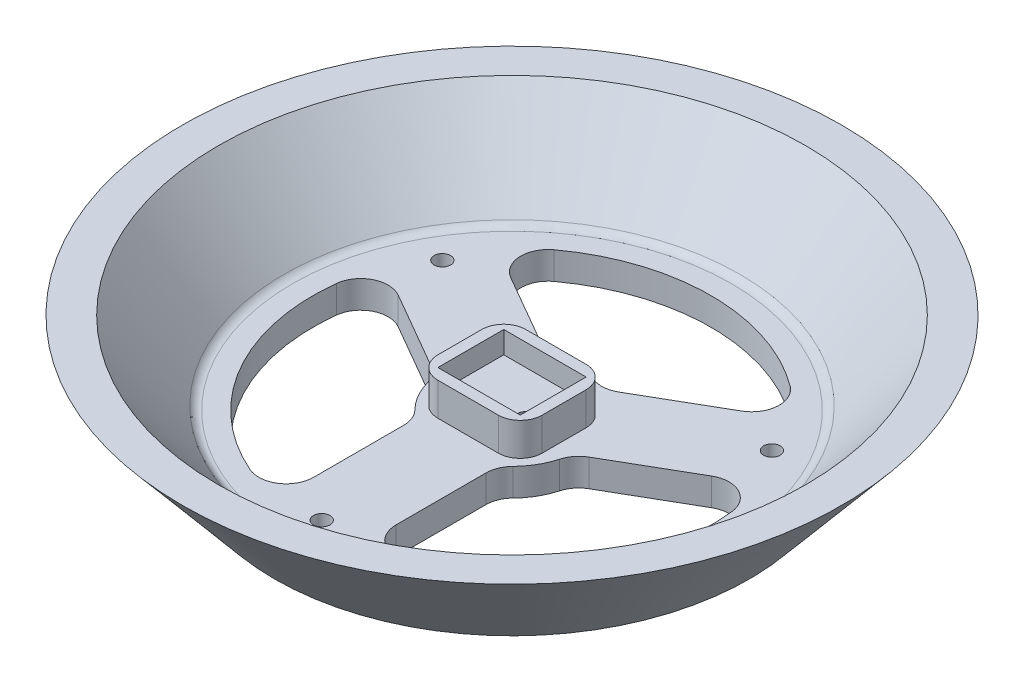
from build123d import *

# Parameters (mm, degrees)
SKETCH1_R                 = 60
BOSS_EXTRUDE1_DEPTH       = 20
BOSS_EXTRUDE1_DRAFT       = -40
SHELL1_T                  = -5
CUT_EXTRUDE2_DEPTH        = 20
SKETCH3_W                 = 15
SKETCH3_H                 = 12
BOSS_EXTRUDE2_DEPTH       = 6
F_3_0MM_DOWEL_HOLE1_D     = 3
FILLET1_R                 = 5
FILLET2_R                 = 2
SKETCH10_W                = 15
SKETCH10_H                = 12
CUT_EXTRUDE3_DEPTH        = 5
SKETCH12_W                = 12
SKETCH12_H                = 3
BOSS_EXTRUDE5_DEPTH       = 7.5
F_3_0MM_DOWEL_HOLE3_D     = 3
F_3_0MM_DOWEL_HOLE3_DEPTH = 15
F_3_0MM_DOWEL_HOLE3_TIP   = 0.901290929


with BuildPart() as part:
    # Sketch1 → Boss-Extrude1 (with draft: the straight prism first)
    with BuildSketch(Plane(origin=(0, 0, 0), x_dir=(1, 0, 0), z_dir=(0, 1, 0))):
        Circle(SKETCH1_R)
    extrude(amount=-BOSS_EXTRUDE1_DEPTH)
    # Boss-Extrude1: the draft: its side faces are tilted about the plane it starts from
    boss_extrude1_sides = [part.faces().sort_by_distance(p)[0] for p in [
        (-60, -10, 0),
    ]]
    draft(boss_extrude1_sides, Plane(origin=(0, 0, 0), x_dir=(1, 0, 0), z_dir=(0, 1, 0)), BOSS_EXTRUDE1_DRAFT)

    # Shell1
    shell1_openings = [part.faces().sort_by_distance(p)[0] for p in [
        (0, 0, 0),
    ]]
    offset(amount=SHELL1_T, openings=shell1_openings, kind=Kind.INTERSECTION)

    # Sketch2 → Cut-Extrude2 (cut)
    with BuildSketch(Plane.XZ.offset(20)):
        with BuildLine():
            ThreePointArc((-7.5, 35.432951589), (-31.365714462, 18.109003688), (-34.435836207, -11.221285266))
            Line((-34.435836207, -11.221285266), (-12.410254038, 1.495190528))
            ThreePointArc((-12.410254038, 1.495190528), (-10.825317547, 6.25), (-7.5, 10))
            Line((-7.5, 10), (-7.5, 35.432951589))
        make_face()
        with BuildLine():
            Line((12.410254038, 1.495190528), (34.435836207, -11.221285266))
            ThreePointArc((34.435836207, -11.221285266), (35.769689879, -5.680963323), (36.218007376, 0))
            ThreePointArc((36.218007376, 0), (28.136978459, 22.804703495), (7.5, 35.432951589))
            Line((7.5, 35.432951589), (7.5, 10))
            ThreePointArc((7.5, 10), (10.825317547, 6.25), (12.410254038, 1.495190528))
        make_face()
        with BuildLine():
            ThreePointArc((-26.935836207, -24.211666323), (0, -36.218007376), (26.935836207, -24.211666323))
            Line((26.935836207, -24.211666323), (4.910254038, -11.495190528))
            ThreePointArc((4.910254038, -11.495190528), (0, -12.5), (-4.910254038, -11.495190528))
            Line((-4.910254038, -11.495190528), (-26.935836207, -24.211666323))
        make_face()
    extrude(amount=-CUT_EXTRUDE2_DEPTH, mode=Mode.SUBTRACT)

    # Sketch3 → Boss-Extrude2 (add)
    with BuildSketch(Plane(origin=(0, -15, 0), x_dir=(1, 0, 0), z_dir=(0, 1, 0))):
        with BuildLine():
            Line((-5.5, -8), (5.5, -8))
            ThreePointArc((5.5, -8), (8.328427125, -6.828427125), (9.5, -4))
            Line((9.5, -4), (9.5, 4))
            ThreePointArc((9.5, 4), (8.328427125, 6.828427125), (5.5, 8))
            Line((5.5, 8), (-5.5, 8))
            ThreePointArc((-5.5, 8), (-8.328427125, 6.828427125), (-9.5, 4))
            Line((-9.5, 4), (-9.5, -4))
            ThreePointArc((-9.5, -4), (-8.328427125, -6.828427125), (-5.5, -8))
        make_face()
        Rectangle(SKETCH3_W, SKETCH3_H, mode=Mode.SUBTRACT)
    extrude(amount=BOSS_EXTRUDE2_DEPTH)

    # Ø3.0mm Dowel Hole1 (through all)
    with Locations(Plane(origin=(0, -15, 0), x_dir=(1, 0, 0), z_dir=(0, 1, 0))):
        with Locations((-29.999119987, 17.32), (29.999119987, 17.32), (0, -34.64)):
            Hole(F_3_0MM_DOWEL_HOLE1_D / 2)

    # Fillet1
    fillet1_edges = [part.edges().sort_by_distance(p)[0] for p in [
        (-26.935836207, -17.5, -24.211666323),
        (-4.910254038, -17.5, -11.495190528),
        (4.910254038, -17.5, -11.495190528),
        (26.935836207, -17.5, -24.211666323),
        (34.435836207, -17.5, -11.221285266),
        (12.410254038, -17.5, 1.495190528),
        (7.5, -17.5, 10),
        (7.5, -17.5, 35.432951589),
        (-7.5, -17.5, 35.432951589),
        (-7.5, -17.5, 10),
        (-12.410254038, -17.5, 1.495190528),
        (-34.435836207, -17.5, -11.221285266),
    ]]
    fillet(fillet1_edges, radius=FILLET1_R)

    # Fillet2
    fillet2_edges = [part.edges().sort_by_distance(p)[0] for p in [
        (-40.886469086, -15, 0),
    ]]
    fillet(fillet2_edges, radius=FILLET2_R)

    # Sketch10 → Cut-Extrude3 (cut)
    with BuildSketch(Plane.XZ.offset(20)):
        Rectangle(SKETCH10_W, SKETCH10_H)
    extrude(amount=-CUT_EXTRUDE3_DEPTH, mode=Mode.SUBTRACT)

    # Sketch12 → Boss-Extrude5 (add, symmetric)
    with BuildSketch(Plane(origin=(0, 0, 0), x_dir=(0, 0, -1), z_dir=(1, 0, 0))):
        with Locations((0, -14.5)):
            Rectangle(SKETCH12_W, SKETCH12_H)
    extrude(amount=BOSS_EXTRUDE5_DEPTH, both=True)

    # Sketch9 → Ø3.0mm Dowel Hole2 (revolve, cut)
    with BuildSketch(Plane(origin=(4.5, -15, 2), x_dir=(0, 0, -1), z_dir=(1, 0, 0))):
        Polygon((0, 0), (0, 15.901290929), (1.5, 15), (1.5, 0), align=None)
    revolve(axis=Axis((4.5, -21.35, 2), (0, 1, 0)), mode=Mode.SUBTRACT)

    # Ø3.0mm Dowel Hole3
    with Locations(Plane(origin=(0, -15, 0), x_dir=(1, 0, 0), z_dir=(0, 1, 0))):
        with Locations((4.5, -2)):
            Hole(F_3_0MM_DOWEL_HOLE3_D / 2, depth=F_3_0MM_DOWEL_HOLE3_DEPTH)
            with Locations((0, 0, -(F_3_0MM_DOWEL_HOLE3_DEPTH + F_3_0MM_DOWEL_HOLE3_TIP / 2))):  # 118° drill point
                Cone(0, F_3_0MM_DOWEL_HOLE3_D / 2, F_3_0MM_DOWEL_HOLE3_TIP, mode=Mode.SUBTRACT)


solid = part.part
